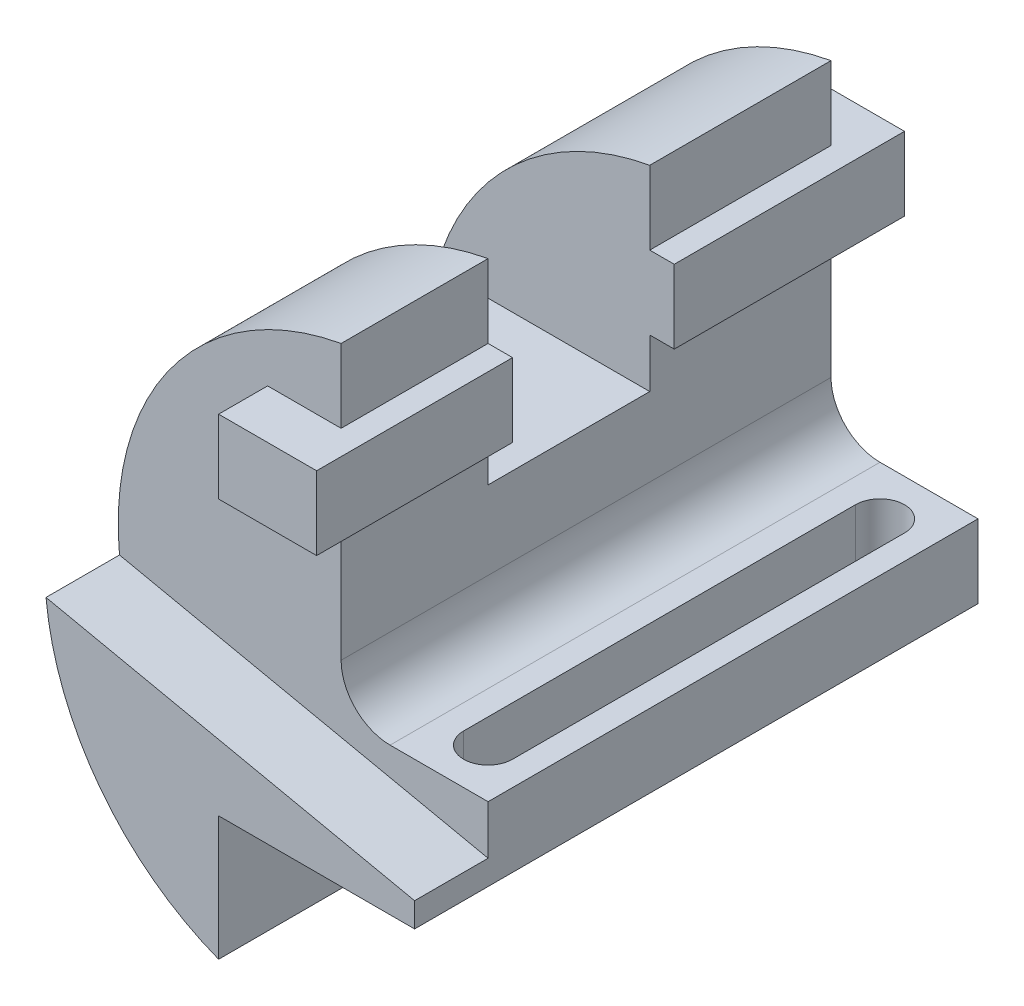
from build123d import *

# Parameters (mm, degrees)
BOSS_EXTRUDE1_DEPTH      = 115
CUT_EXTRUDE2_START       = -15
CUT_EXTRUDE2_DEPTH       = 15
BOSS_EXTRUDE3_DEPTH      = 10
BOSS_EXTRUDE3_DEPTH_BACK = 110
SKETCH2_W                = 20
SKETCH2_H                = 15
CUT_EXTRUDE3_DEPTH       = 148.83859442
CUT_EXTRUDE3_DEPTH_BACK  = 148.83859442
SKETCH7_W                = 33
SKETCH7_H                = 40
CUT_EXTRUDE4_DEPTH       = 153.581945197
CUT_EXTRUDE4_DEPTH_BACK  = 153.581945197


with BuildPart() as part:
    # Sketch1 → Boss-Extrude1 (new body)
    with BuildSketch(Plane.XY):
        with BuildLine():
            Line((0, 0), (-40, 0))
            Line((-40, 0), (-40, -25.362796982))
            ThreePointArc((-40, -25.362796982), (-75.256322222, 31.603413808), (-30, 81))
            Line((-30, 81), (-30, 25))
            ThreePointArc((-30, 25), (-27.071067812, 17.928932188), (-20, 15))
            Line((-20, 15), (0, 15))
            Line((0, 15), (0, 0))
        make_face()
    extrude(amount=BOSS_EXTRUDE1_DEPTH)

    # Sketch4 → Cut-Extrude2 (cut)
    with BuildSketch(Plane.XY.offset(115).offset(CUT_EXTRUDE2_START)):
        with BuildLine():
            Line((0, 5), (-75.235044142, 20.9917023))
            ThreePointArc((-75.235044142, 20.9917023), (-64.318751046, 59.816391467), (-30, 81))
            Line((-30, 81), (-30, 25))
            ThreePointArc((-30, 25), (-27.071067812, 17.928932188), (-20, 15))
            Line((-20, 15), (0, 15))
            Line((0, 15), (0, 5))
        make_face()
    extrude(amount=CUT_EXTRUDE2_DEPTH, mode=Mode.SUBTRACT)

    # Sketch2 → Boss-Extrude3 (add, two sides: drawn at the far end of the back side and taken through both)
    with BuildSketch(Plane(origin=(0, 0, 0), x_dir=(-1, 0, 0), z_dir=(0, 0, -1)).offset(-BOSS_EXTRUDE3_DEPTH_BACK)):
        with Locations((35, 58.5)):
            Rectangle(SKETCH2_W, SKETCH2_H)
    extrude(amount=BOSS_EXTRUDE3_DEPTH + BOSS_EXTRUDE3_DEPTH_BACK)

    # Sketch7 → Cut-Extrude3 (cut, two sides: drawn at the far end of the back side and taken through both)
    with BuildSketch(Plane(origin=(-30, 0, 0), x_dir=(0, 0, -1), z_dir=(1, 0, 0)).offset(-CUT_EXTRUDE3_DEPTH_BACK)):
        with Locations((-53.5, 61)):
            Rectangle(SKETCH7_W, SKETCH7_H)
    extrude(amount=CUT_EXTRUDE3_DEPTH + CUT_EXTRUDE3_DEPTH_BACK, mode=Mode.SUBTRACT)

    # Sketch8 → Cut-Extrude4 (cut, two sides: drawn at the far end of the back side and taken through both)
    with BuildSketch(Plane(origin=(0, 15, 0), x_dir=(1, 0, 0), z_dir=(0, 1, 0)).offset(-CUT_EXTRUDE4_DEPTH_BACK)):
        with BuildLine():
            Line((-5, -10), (-5, -90))
            ThreePointArc((-5, -90), (-10, -95), (-15, -90))
            Line((-15, -90), (-15, -10))
            ThreePointArc((-15, -10), (-10, -5), (-5, -10))
        make_face()
    extrude(amount=CUT_EXTRUDE4_DEPTH + CUT_EXTRUDE4_DEPTH_BACK, mode=Mode.SUBTRACT)


solid = part.part
